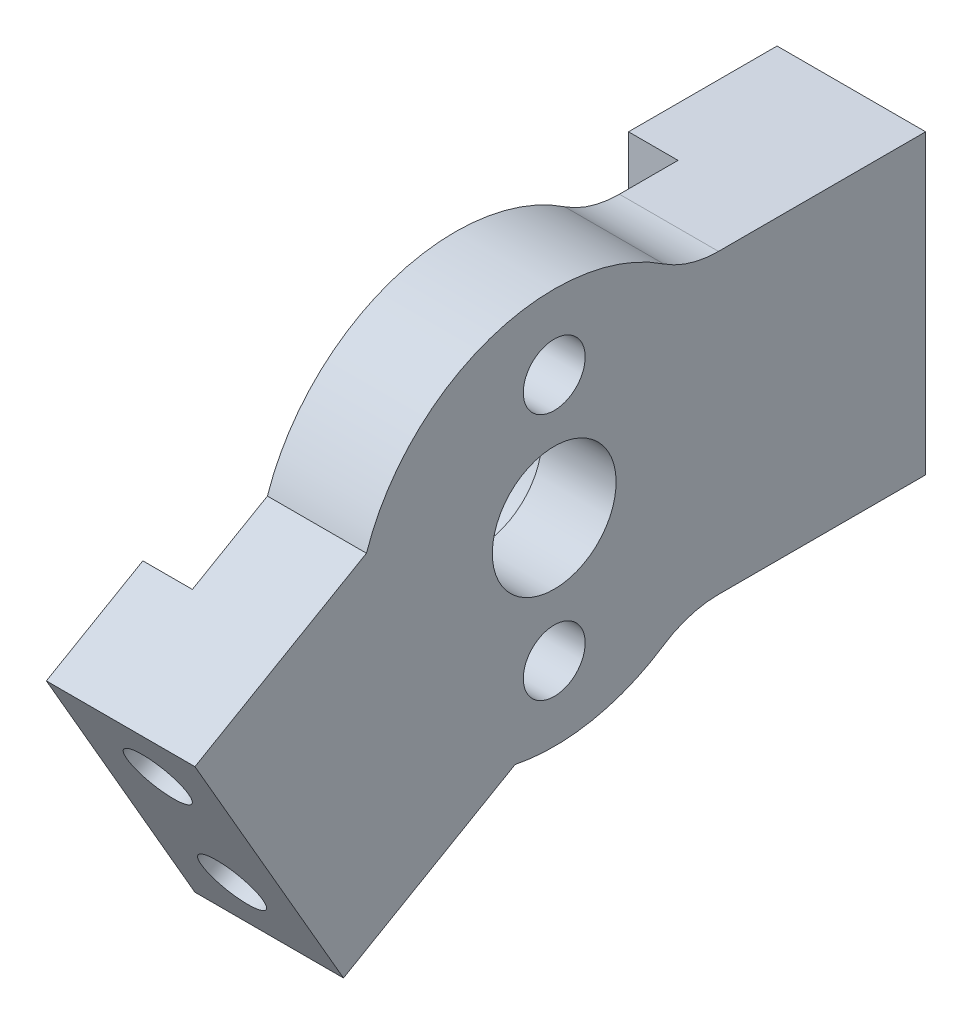
from build123d import *

# Parameters (mm, degrees)
SKETCH1_W       = 6
SKETCH1_H       = 12
EXTRUDE1_DEPTH  = 6
SKETCH3_W       = 4
SKETCH3_H       = 8.6
EXTRUDE2_DEPTH  = 1
SKETCH2_R       = 1.25
EXTRUDE3_DEPTH  = 5.5
EXTRUDE4_DEPTH  = 4
SKETCH6_R       = 3
EXTRUDE5_DEPTH  = 1
SKETCH7_R       = 1.25
EXTRUDE6_DEPTH  = 4
SKETCH8_R       = 2.5
EXTRUDE7_DEPTH  = 3
FILLET1_R       = 4
EXTRUDE9_START  = -4
EXTRUDE9_DEPTH  = 4
EXTRUDE10_DEPTH = 2
SKETCH14_R      = 1.25
EXTRUDE11_DEPTH = 4


with BuildPart() as part:
    # Sketch1 → Extrude1 (new body)
    with BuildSketch(Plane.XY):
        with Locations((-1, 0)):
            Rectangle(SKETCH1_W, SKETCH1_H)
    extrude(amount=EXTRUDE1_DEPTH)

    # Sketch3 → Extrude2 (add)
    with BuildSketch(Plane.XY.offset(6)):
        Rectangle(SKETCH3_W, SKETCH3_H)
    extrude(amount=EXTRUDE2_DEPTH)

    # Sketch2 → Extrude3 (cut)
    with BuildSketch(Plane(origin=(0, 0, 0), x_dir=(-1, 0, 0), z_dir=(0, 0, -1))):
        with Locations((1, 3)):
            Circle(SKETCH2_R)
        with Locations((1, -3)):
            Circle(SKETCH2_R)
    extrude(amount=-EXTRUDE3_DEPTH, mode=Mode.SUBTRACT)

    # Sketch4 → Extrude4 (add)
    with BuildSketch(Plane(origin=(2, 0, 0), x_dir=(0, 0, -1), z_dir=(1, 0, 0))):
        with BuildLine():
            Line((-9.708497378, 6), (-6, 6))
            Line((-6, 6), (-6, -6))
            Line((-6, -6), (-9.708497378, -6))
            ThreePointArc((-9.708497378, -6), (-23, 0), (-9.708497378, 6))
        make_face()
    extrude(amount=-EXTRUDE4_DEPTH)

    # Sketch6 → Extrude5 (cut)
    with BuildSketch(Plane.ZY.offset(2)):
        with Locations(Location((15, 0, 0), (0, 0, 270))):
            Circle(SKETCH6_R)
    extrude(amount=-EXTRUDE5_DEPTH, mode=Mode.SUBTRACT)

    # Sketch7 → Extrude6 (cut)
    with BuildSketch(Plane.ZY.offset(2)):
        with Locations(Location((15, -5, 0), (0, 0, 270))):
            Circle(SKETCH7_R)
        with Locations(Location((15, 5, 0), (0, 0, 270))):
            Circle(SKETCH7_R)
    extrude(amount=-EXTRUDE6_DEPTH, mode=Mode.SUBTRACT)

    # Sketch8 → Extrude7 (cut)
    with BuildSketch(Plane.ZY.offset(1)):
        with Locations(Location((15, 0, 0), (0, 0, 270))):
            Circle(SKETCH8_R)
    extrude(amount=-EXTRUDE7_DEPTH, mode=Mode.SUBTRACT)

    # Fillet1
    fillet1_edges = [part.edges().sort_by_distance(p)[0] for p in [
        (0, -6, 9.708497378),
        (0, 6, 9.708497378),
    ]]
    fillet(fillet1_edges, radius=FILLET1_R)

    # Sketch12 → Extrude9 (add)
    with BuildSketch(Plane.ZY.offset(2).offset(EXTRUDE9_START)):
        with BuildLine():
            Line((16.582575695, -7.841903734), (23.510778925, -11.841903734))
            Line((23.510778925, -11.841903734), (29.510778925, -1.449598888))
            Line((29.510778925, -1.449598888), (22.582575695, 2.550401112))
            ThreePointArc((22.582575695, 2.550401112), (21.92820323, -4), (16.582575695, -7.841903734))
        make_face()
    extrude(amount=EXTRUDE9_DEPTH)

    # Sketch13 → Extrude10 (add)
    with BuildSketch(Plane.ZY.offset(2)):
        Polygon((29.510778925, -1.449598888), (25.613664608, 0.800401112), (19.613664608, -9.591903734), (23.510778925, -11.841903734), align=None)
    extrude(amount=EXTRUDE10_DEPTH)

    # Sketch14 → Extrude11 (cut)
    with BuildSketch(Plane(origin=(0, -13.140941839, 22.760778925), x_dir=(1, 0, 0), z_dir=(0, -0.5000000000000007, 0.8660254037844383))):
        with Locations(Location((-1, 4.5, 0), (0, 0, 270))):
            Circle(SKETCH14_R)
        with Locations(Location((-1, 10.5, 0), (0, 0, 270))):
            Circle(SKETCH14_R)
    extrude(amount=-EXTRUDE11_DEPTH, mode=Mode.SUBTRACT)


solid = part.part
